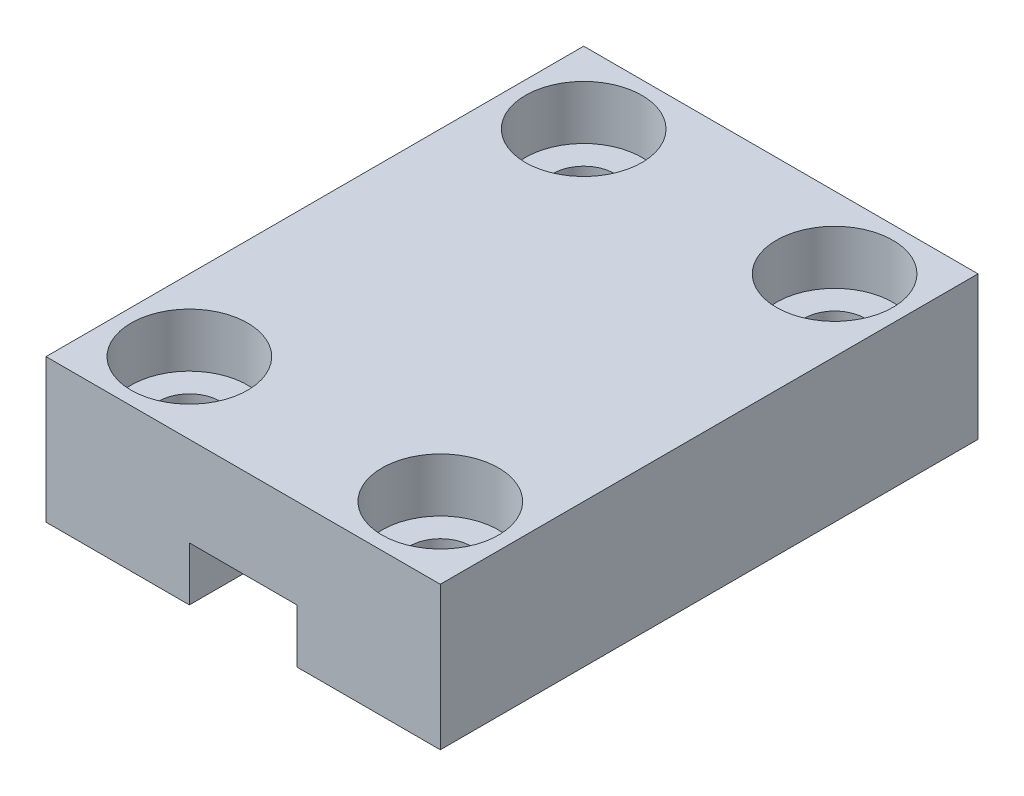
from build123d import *

# Parameters (mm, degrees)
EXTRUDE_1_DEPTH             = 30
HOLE_WIZARD_M31_D           = 3.4
HOLE_WIZARD_M31_CBORE_D     = 6.5
HOLE_WIZARD_M31_CBORE_DEPTH = 3


with BuildPart() as part:
    # Эскиз1 → Бобышка-Вытянуть1 (new body)
    with BuildSketch(Plane.XY):
        Polygon((-3, 0), (-11, 0), (-11, 8), (11, 8), (11, 0), (3, 0), (3, 3), (-3, 3), align=None)
    extrude(amount=EXTRUDE_1_DEPTH)

    # Цековка для винта с внутренним шестигранником M31 (through all)
    with Locations(Plane(origin=(0, 8, 0), x_dir=(1, 0, 0), z_dir=(0, 1, 0))):
        with Locations((-7, -4), (7, -4), (7, -26), (-7, -26)):
            CounterBoreHole(HOLE_WIZARD_M31_D / 2, HOLE_WIZARD_M31_CBORE_D / 2, HOLE_WIZARD_M31_CBORE_DEPTH)


solid = part.part
